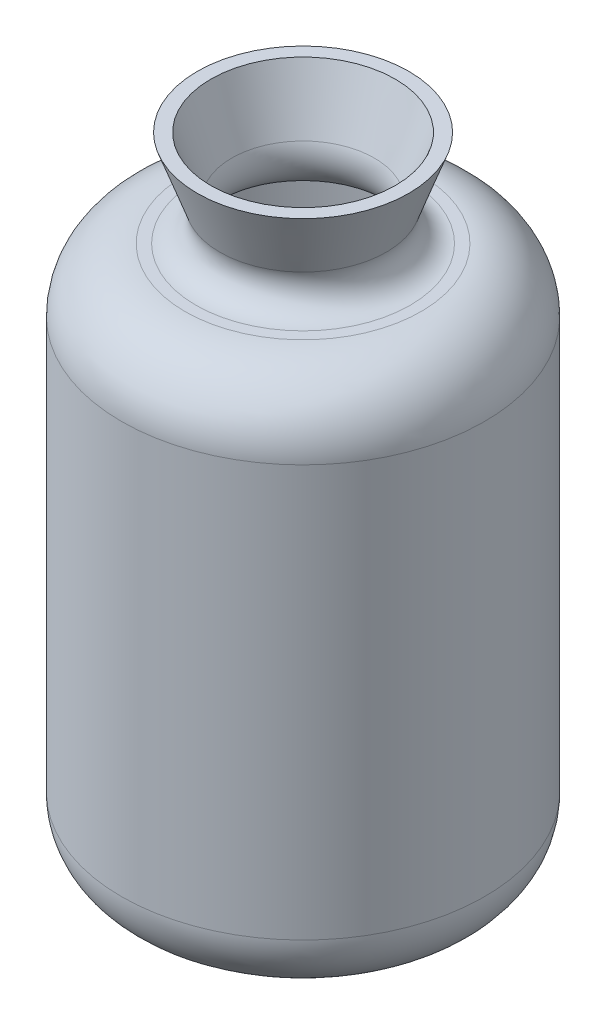
from build123d import *

# Parameters (mm, degrees)
SHELL1_T = -2.54


with BuildPart() as part:
    # Sketch1 → Revolve1 (revolve)
    with BuildSketch(Plane.XY, mode=Mode.PRIVATE) as revolve1_sk:
        with BuildLine():
            Line((0, 68.313709677), (-21.160220955, 68.313709677))
            Line((-21.160220955, 68.313709677), (-16.658133593, 55.866762263))
            ThreePointArc((-16.658133593, 55.866762263), (-17.276874479, 51.220934006), (-21.435244819, 49.058870968))
            Line((-21.435244819, 49.058870968), (-23.618285471, 49.058870968))
            ThreePointArc((-23.618285471, 49.058870968), (-32.598541593, 45.339127089), (-36.318285471, 36.358870968))
            Line((-36.318285471, 36.358870968), (-36.318285471, -45.986290323))
            ThreePointArc((-36.318285471, -45.986290323), (-32.598541593, -54.966546444), (-23.618285471, -58.686290323))
            Line((-23.618285471, -58.686290323), (0, -58.686290323))
            Line((0, -58.686290323), (0, 68.313709677))
        make_face()
    revolve(revolve1_sk.sketch.rotate(Axis((0, 68.313709677, 0), (0, -1, 0)), 270), axis=Axis((0, 68.313709677, 0), (0, -1, 0)))

    # Shell1
    shell1_openings = [part.faces().sort_by_distance(p)[0] for p in [
        (0, 68.313709677, 0),
    ]]
    offset(amount=SHELL1_T, openings=shell1_openings, kind=Kind.INTERSECTION)


solid = part.part
